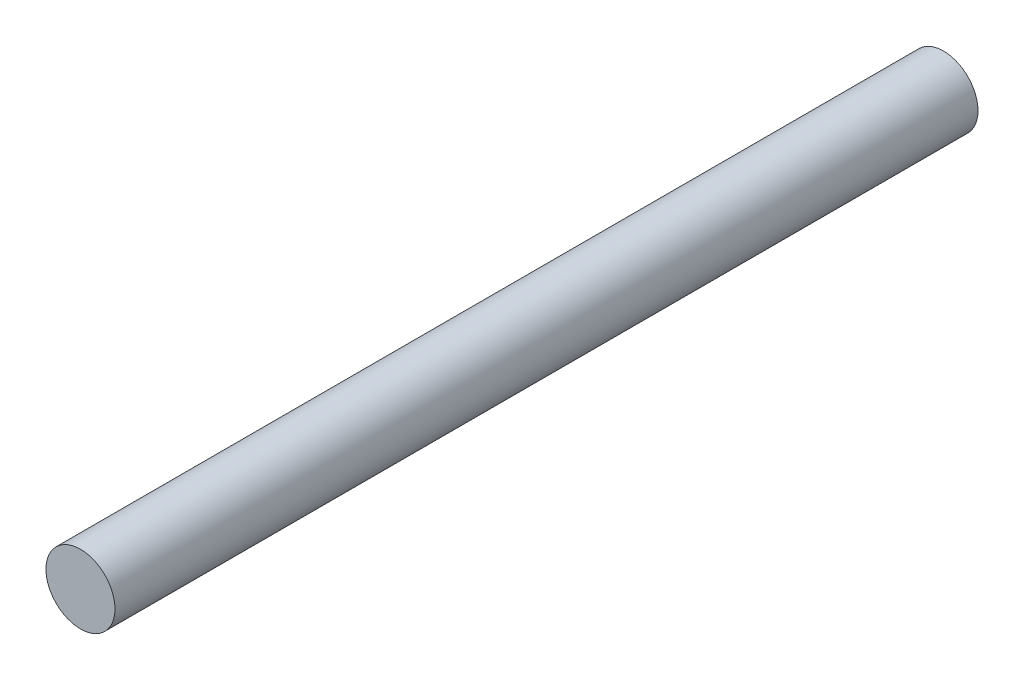
from build123d import *

# Parameters (mm, degrees)
ESQUISSE1_R        = 4
BOSS_EXTRU_1_DEPTH = 100


with BuildPart() as part:
    # Esquisse1 → Boss.-Extru.1 (new body)
    with BuildSketch(Plane(origin=(0, 0, 0), x_dir=(0, 1, 0), z_dir=(0, 0, 1))):
        with Locations(Location((0, 0, 0), (0, 0, 270))):
            Circle(ESQUISSE1_R)
    extrude(amount=BOSS_EXTRU_1_DEPTH)


solid = part.part
